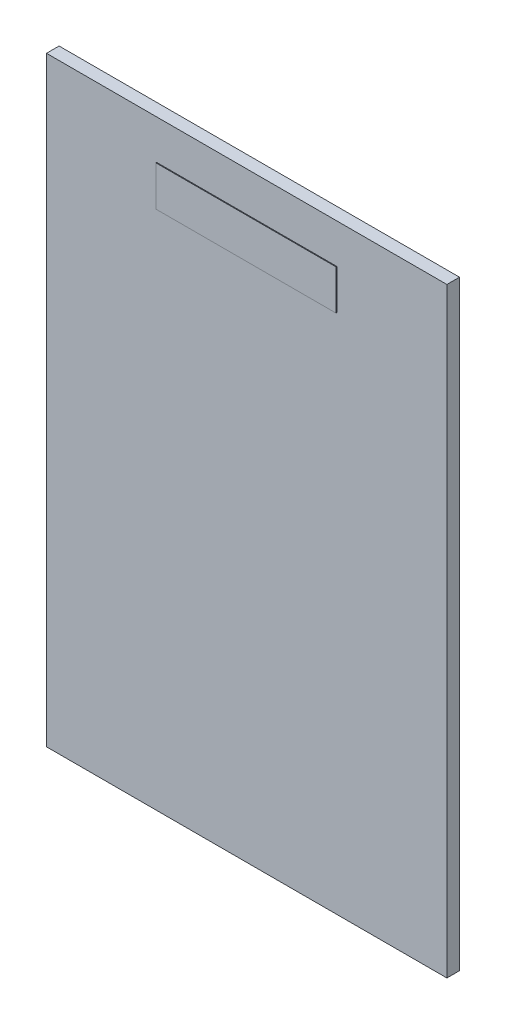
from build123d import *

# Parameters (mm, degrees)
SKETCH1_W           = 50.8
SKETCH1_H           = 76.2
BOSS_EXTRUDE1_DEPTH = 1.6
SKETCH3_W           = 22.86
SKETCH3_H           = 5.08
BOSS_EXTRUDE2_DEPTH = 0.1
SKETCH6_W           = 28.557161976
SKETCH6_H           = 42.013432375
BOSS_EXTRUDE3_DEPTH = 2


with BuildPart() as part:
    # Sketch1 → Boss-Extrude1 (new body)
    with BuildSketch(Plane.XY):
        Rectangle(SKETCH1_W, SKETCH1_H)
    extrude(amount=BOSS_EXTRUDE1_DEPTH)

    # Sketch3 → Boss-Extrude2 (add)
    with BuildSketch(Plane.XY.offset(1.6)):
        with Locations((0, 30.56)):
            Rectangle(SKETCH3_W, SKETCH3_H)
    extrude(amount=BOSS_EXTRUDE2_DEPTH)

    # Sketch6 → Boss-Extrude3 (add)
    with BuildSketch(Plane(origin=(0, 0, 0), x_dir=(-1, 0, 0), z_dir=(0, 0, -1))):
        with Locations((0, 1.728458928)):
            Rectangle(SKETCH6_W, SKETCH6_H)
    extrude(amount=BOSS_EXTRUDE3_DEPTH)


solid = part.part
